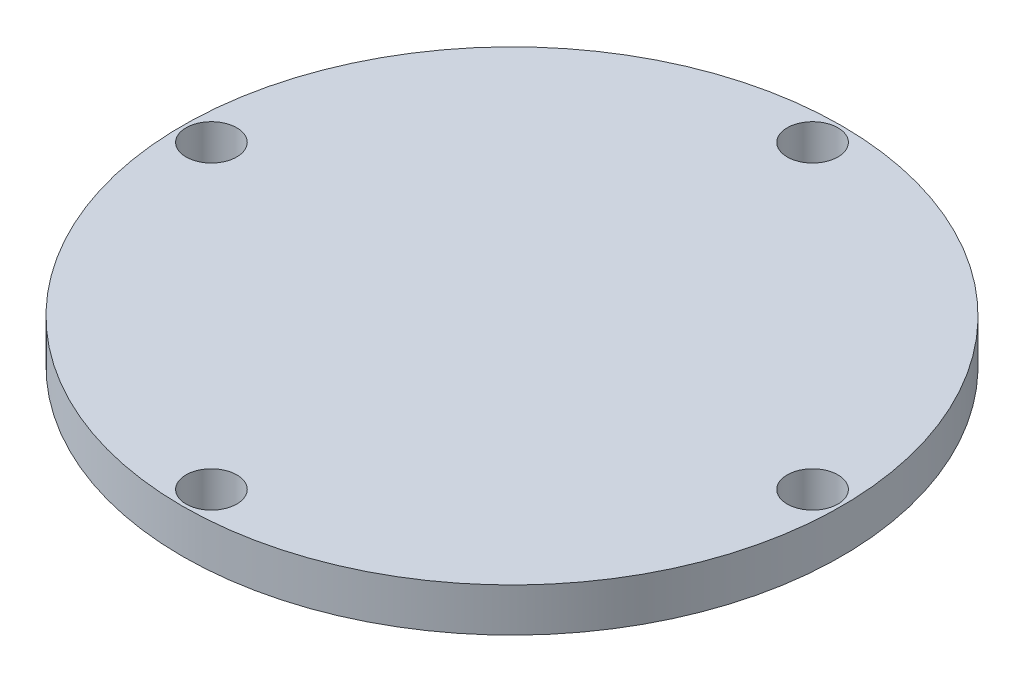
from build123d import *

# Parameters (mm, degrees)
OUTTER_R          = 11.557
BODY_DEPTH        = 1.524
SCREW_HOLES_COUNT = 4


with BuildPart() as part:
    # outter → Body (new body)
    with BuildSketch(Plane(origin=(0, 0, 0), x_dir=(1, 0, 0), z_dir=(0, 1, 0))):
        Circle(OUTTER_R)
    extrude(amount=-BODY_DEPTH)

    # Sketch12 → #0 Clearance Hole (revolve, cut)
    with BuildSketch(Plane(origin=(0, 0, -10.541), x_dir=(0, 0, 1), z_dir=(1, 0, 0))):
        Polygon((0, 0), (0, 2.05816509), (0.889, 1.524), (0.889, 0), align=None)
    f_0_clearance_hole = revolve(axis=Axis((0, 6.35, -10.541), (0, -1, 0)), mode=Mode.SUBTRACT)

    # Screw Holes: #0 Clearance Hole ×4 about axis
    screw_holes_axis = Axis((0, 0.0762, 0), (0, -1, 0))
    for i in range(1, SCREW_HOLES_COUNT):
        add(f_0_clearance_hole.rotate(screw_holes_axis, i * 360 / SCREW_HOLES_COUNT), mode=Mode.SUBTRACT)


solid = part.part
